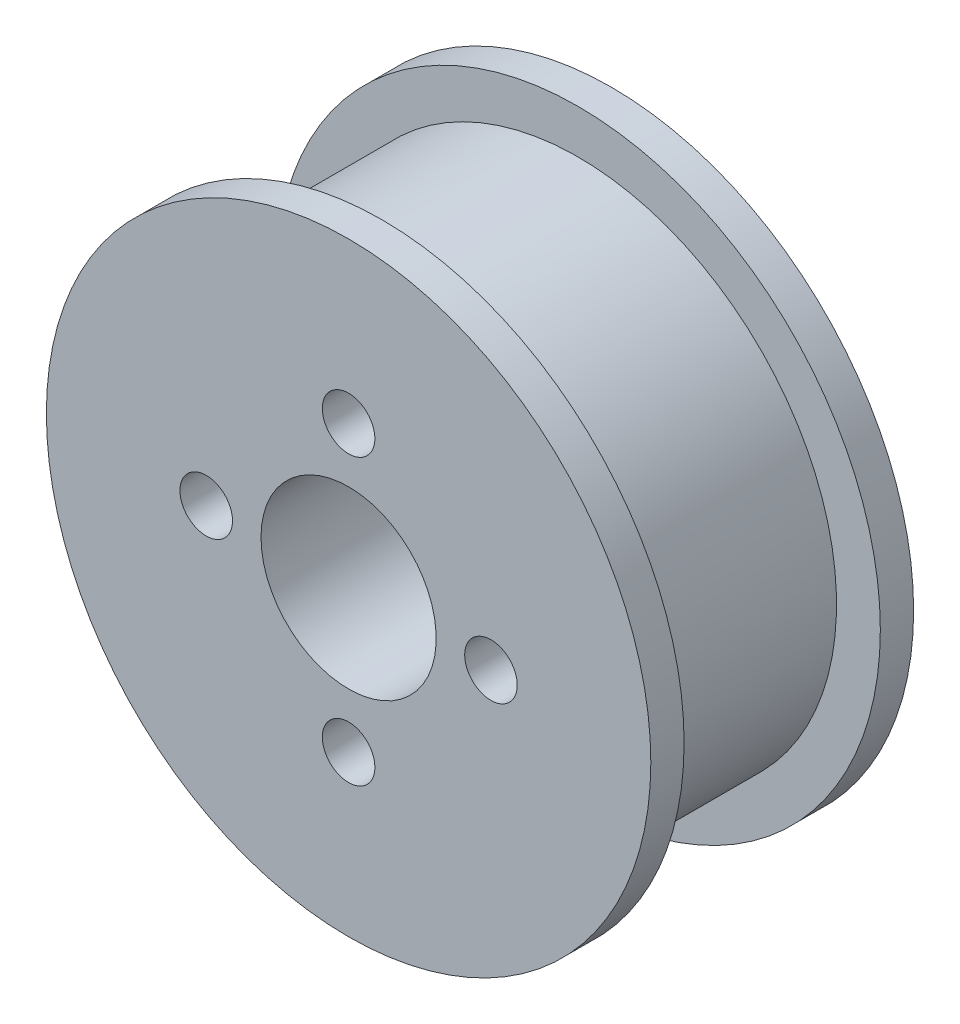
from build123d import *

# Parameters (mm, degrees)
SKETCH1_R           = 17.25
BOSS_EXTRUDE1_DEPTH = 1.9
SKETCH2_R           = 14.75
BOSS_EXTRUDE2_DEPTH = 11.2
BOSS_EXTRUDE3_START = 1.9
SKETCH3_R           = 17.25
BOSS_EXTRUDE3_DEPTH = 1.9
SKETCH4_R           = 5
CUT_EXTRUDE1_DEPTH  = 29.637824638
SKETCH5_R           = 1.5
CUT_EXTRUDE2_DEPTH  = 29.637824638


with BuildPart() as part:
    # Sketch1 → Boss-Extrude1 (new body)
    with BuildSketch(Plane.XY):
        with Locations(Location((0, 0, 0), (0, 0, 180))):
            Circle(SKETCH1_R)
    extrude(amount=BOSS_EXTRUDE1_DEPTH)

    # Sketch2 → Boss-Extrude2 (add)
    with BuildSketch(Plane(origin=(0, 0, 0), x_dir=(-1, 0, 0), z_dir=(0, 0, -1))):
        Circle(SKETCH2_R)
    extrude(amount=BOSS_EXTRUDE2_DEPTH)

    # Sketch3 → Boss-Extrude3 (add)
    with BuildSketch(Plane(origin=(0, 0, -11.2), x_dir=(-1, 0, 0), z_dir=(0, 0, -1)).offset(BOSS_EXTRUDE3_START)):
        Circle(SKETCH3_R)
    extrude(amount=-BOSS_EXTRUDE3_DEPTH)

    # Sketch4 → Cut-Extrude1 (cut, through all)
    with BuildSketch(Plane(origin=(0, 0, -13.1), x_dir=(-1, 0, 0), z_dir=(0, 0, -1))):
        Circle(SKETCH4_R)
    extrude(amount=-CUT_EXTRUDE1_DEPTH, mode=Mode.SUBTRACT)

    # Sketch5 → Cut-Extrude2 (cut, through all)
    with BuildSketch(Plane(origin=(0, 0, -13.1), x_dir=(-1, 0, 0), z_dir=(0, 0, -1))):
        with Locations((0, 8.125)):
            Circle(SKETCH5_R)
        with Locations((8.125, 0)):
            Circle(SKETCH5_R)
        with Locations((0, -8.125)):
            Circle(SKETCH5_R)
        with Locations((-8.125, 0)):
            Circle(SKETCH5_R)
    extrude(amount=-CUT_EXTRUDE2_DEPTH, mode=Mode.SUBTRACT)


solid = part.part
